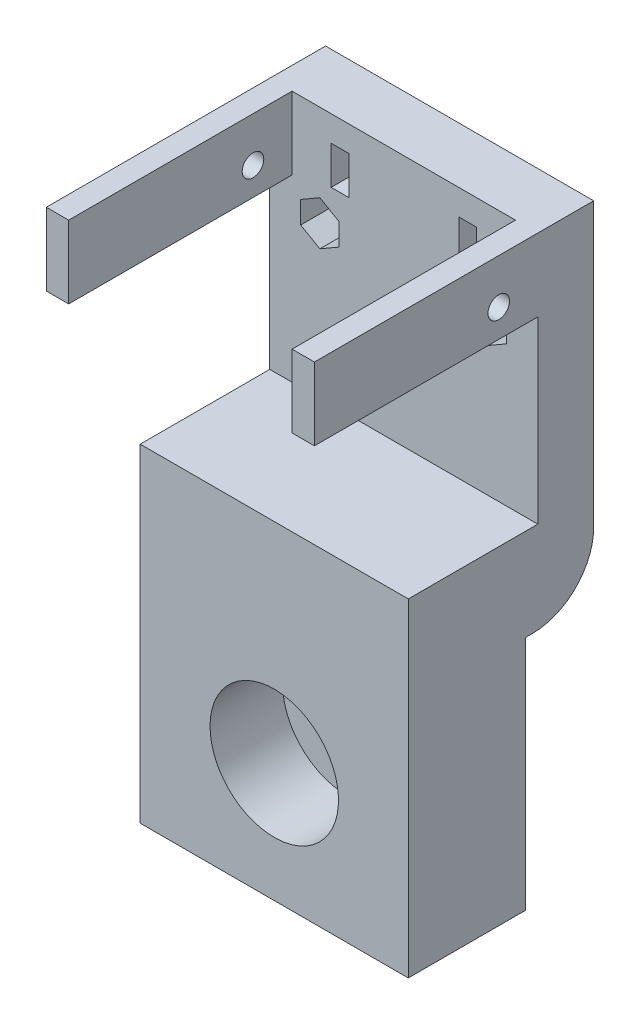
from build123d import *

# Parameters (mm, degrees)
SKETCH1_W           = 48
SKETCH1_H           = 53
SKETCH1_R           = 1.9304
BOSS_EXTRUDE1_DEPTH = 10
SKETCH2_W           = 48
SKETCH2_H           = 5.616325
BOSS_EXTRUDE2_DEPTH = 33.1917878
SKETCH4_W           = 4
SKETCH4_H           = 10
BOSS_EXTRUDE4_DEPTH = 40
SKETCH5_W           = 48
SKETCH5_H           = 10.8609375
BOSS_EXTRUDE5_DEPTH = 23.1917878
SKETCH6_W           = 48
SKETCH6_H           = 5
BOSS_EXTRUDE6_DEPTH = 42.3
CUT_EXTRUDE1_REACH  = 78.862
SKETCH8_R           = 11.5
SKETCH9_R           = 1.9304
CUT_EXTRUDE2_DEPTH  = 88.252507127
CUT_EXTRUDE3_REACH  = 89.253
SKETCH10_W          = 3.15468
SKETCH10_H          = 6.8326
BOSS_EXTRUDE7_START = 8
SKETCH11_W          = 48
SKETCH11_H          = 42.3
SKETCH11_R          = 11.5
BOSS_EXTRUDE7_DEPTH = 8
SKETCH12_W          = 48
SKETCH12_H          = 42.3
BOSS_EXTRUDE8_DEPTH = 8
FILLET1_R           = 11
BOSS_EXTRUDE9_DEPTH = 3
CUT_EXTRUDE4_DEPTH  = 6


with BuildPart() as part:
    # Sketch1 → Boss-Extrude1 (new body)
    with BuildSketch(Plane.XY):
        with Locations((24, 26.5)):
            Rectangle(SKETCH1_W, SKETCH1_H)
        with Locations((8.975, 38)):
            Circle(SKETCH1_R, mode=Mode.SUBTRACT)
        with Locations((38.975, 38)):
            Circle(SKETCH1_R, mode=Mode.SUBTRACT)
    extrude(amount=BOSS_EXTRUDE1_DEPTH)

    # Sketch2 → Boss-Extrude2 (add)
    with BuildSketch(Plane(origin=(0, 0, 0), x_dir=(-1, 0, 0), z_dir=(0, 0, -1))):
        with Locations((-24, -2.8081625)):
            Rectangle(SKETCH2_W, SKETCH2_H)
    extrude(amount=-BOSS_EXTRUDE2_DEPTH)

    # Sketch4 → Boss-Extrude4 (add)
    with BuildSketch(Plane.XY.offset(10)):
        with Locations((2, 48)):
            Rectangle(SKETCH4_W, SKETCH4_H)
        with Locations((46, 48)):
            Rectangle(SKETCH4_W, SKETCH4_H)
    extrude(amount=BOSS_EXTRUDE4_DEPTH)

    # Sketch5 → Boss-Extrude5 (add)
    with BuildSketch(Plane.XY.offset(10)):
        with Locations((24, 5.43046875)):
            Rectangle(SKETCH5_W, SKETCH5_H)
    extrude(amount=BOSS_EXTRUDE5_DEPTH)

    # Sketch6 → Boss-Extrude6 (add)
    with BuildSketch(Plane.XZ.offset(5.616325)):
        with Locations((24, 30.6917878)):
            Rectangle(SKETCH6_W, SKETCH6_H)
    extrude(amount=BOSS_EXTRUDE6_DEPTH)

    # Sketch8 → Cut-Extrude1 (cut, up to next)
    with BuildSketch(Plane(origin=(0, 0, 28.1917878), x_dir=(-1, 0, 0), z_dir=(0, 0, -1)), mode=Mode.PRIVATE) as cut_extrude1_sk1:
        with Locations((-24, -26.616325)):
            Circle(SKETCH8_R)
    cut_extrude1_tool1 = extrude(cut_extrude1_sk1.sketch, amount=-CUT_EXTRUDE1_REACH, mode=Mode.PRIVATE) & part.part
    add(cut_extrude1_tool1.solids().sort_by_distance((24, -26.616325, 28.191788))[0], mode=Mode.SUBTRACT)

    # Sketch9 → Cut-Extrude2 (cut, through all)
    with BuildSketch(Plane(origin=(48, 0, 0), x_dir=(0, 0, -1), z_dir=(1, 0, 0))):
        with Locations((-17, 48)):
            Circle(SKETCH9_R)
    extrude(amount=-CUT_EXTRUDE2_DEPTH, mode=Mode.SUBTRACT)

    # Sketch10 → Cut-Extrude3 (cut, up to next)
    with BuildSketch(Plane(origin=(0, 0, 0), x_dir=(-1, 0, 0), z_dir=(0, 0, -1)), mode=Mode.PRIVATE) as cut_extrude3_sk1:
        with Locations((-35.42266, 48)):
            Rectangle(SKETCH10_W, SKETCH10_H)
    cut_extrude3_tool1 = extrude(cut_extrude3_sk1.sketch, amount=-CUT_EXTRUDE3_REACH, mode=Mode.PRIVATE) & part.part
    # Sketch10 → Cut-Extrude3 (cut, up to next)
    with BuildSketch(Plane(origin=(0, 0, 0), x_dir=(-1, 0, 0), z_dir=(0, 0, -1)), mode=Mode.PRIVATE) as cut_extrude3_sk2:
        with Locations((-12.57734, 48)):
            Rectangle(SKETCH10_W, SKETCH10_H)
    cut_extrude3_tool2 = extrude(cut_extrude3_sk2.sketch, amount=-CUT_EXTRUDE3_REACH, mode=Mode.PRIVATE) & part.part
    add(cut_extrude3_tool1.solids().sort_by_distance((35.42266, 48, 0))[0], mode=Mode.SUBTRACT)
    add(cut_extrude3_tool2.solids().sort_by_distance((12.57734, 48, 0))[0], mode=Mode.SUBTRACT)

    # Sketch11 → Boss-Extrude7 (add)
    with BuildSketch(Plane(origin=(0, 0, 28.1917878), x_dir=(-1, 0, 0), z_dir=(0, 0, -1)).offset(BOSS_EXTRUDE7_START)):
        with Locations((-24, -26.766325)):
            Rectangle(SKETCH11_W, SKETCH11_H)
        with Locations((-24, -26.616325)):
            Circle(SKETCH11_R, mode=Mode.SUBTRACT)
    extrude(amount=-BOSS_EXTRUDE7_DEPTH)

    # Sketch12 → Boss-Extrude8 (add)
    with BuildSketch(Plane(origin=(0, 0, 20.1917878), x_dir=(-1, 0, 0), z_dir=(0, 0, -1))):
        with Locations((-24, -26.766325)):
            Rectangle(SKETCH12_W, SKETCH12_H)
    extrude(amount=BOSS_EXTRUDE8_DEPTH)

    # Fillet1
    fillet1_edges = [part.edges().sort_by_distance(p)[0] for p in [
        (24, -5.616325, 0),
    ]]
    fillet(fillet1_edges, radius=FILLET1_R)

    # Sketch13 → Boss-Extrude9 (add)
    with BuildSketch(Plane(origin=(0, 53, 0), x_dir=(1, 0, 0), z_dir=(0, 1, 0))):
        Polygon((0, 0), (0, -50), (4, -50), (4, -10), (44, -10), (44, -50), (48, -50), (48, 0), align=None)
    extrude(amount=BOSS_EXTRUDE9_DEPTH)

    # Sketch14 → Cut-Extrude4 (cut)
    with BuildSketch(Plane.XY.offset(10)):
        Polygon((8.975, 41.9594682), (5.545999953, 39.9797341), (5.545999953, 36.0202659), (8.975, 34.0405318), (12.404000047, 36.0202659), (12.404000047, 39.9797341), align=None)
        Polygon((38.975, 41.9594682), (35.545999953, 39.9797341), (35.545999953, 36.0202659), (38.975, 34.0405318), (42.404000047, 36.0202659), (42.404000047, 39.9797341), align=None)
    extrude(amount=-CUT_EXTRUDE4_DEPTH, mode=Mode.SUBTRACT)


solid = part.part
